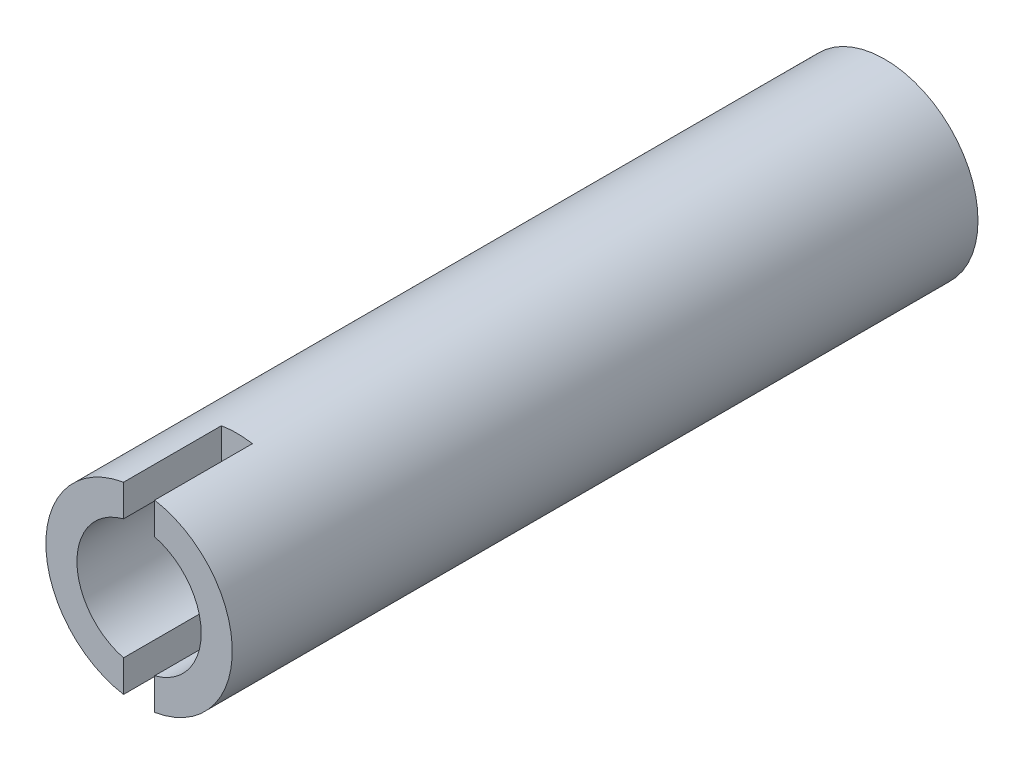
from build123d import *

# Parameters (mm, degrees)
SKETCH1_R           = 9.525
SKETCH1_R_2         = 6.35
BOSS_EXTRUDE1_DEPTH = 76.2
SKETCH2_W           = 3.175
SKETCH2_H           = 25.179063452
CUT_EXTRUDE1_DEPTH  = 10


with BuildPart() as part:
    # Sketch1 → Boss-Extrude1 (new body)
    with BuildSketch(Plane.XY):
        Circle(SKETCH1_R)
        Circle(SKETCH1_R_2, mode=Mode.SUBTRACT)
    extrude(amount=BOSS_EXTRUDE1_DEPTH)

    # Sketch2 → Cut-Extrude1 (cut)
    with BuildSketch(Plane.XY.offset(76.2)):
        Rectangle(SKETCH2_W, SKETCH2_H)
    extrude(amount=-CUT_EXTRUDE1_DEPTH, mode=Mode.SUBTRACT)


solid = part.part
